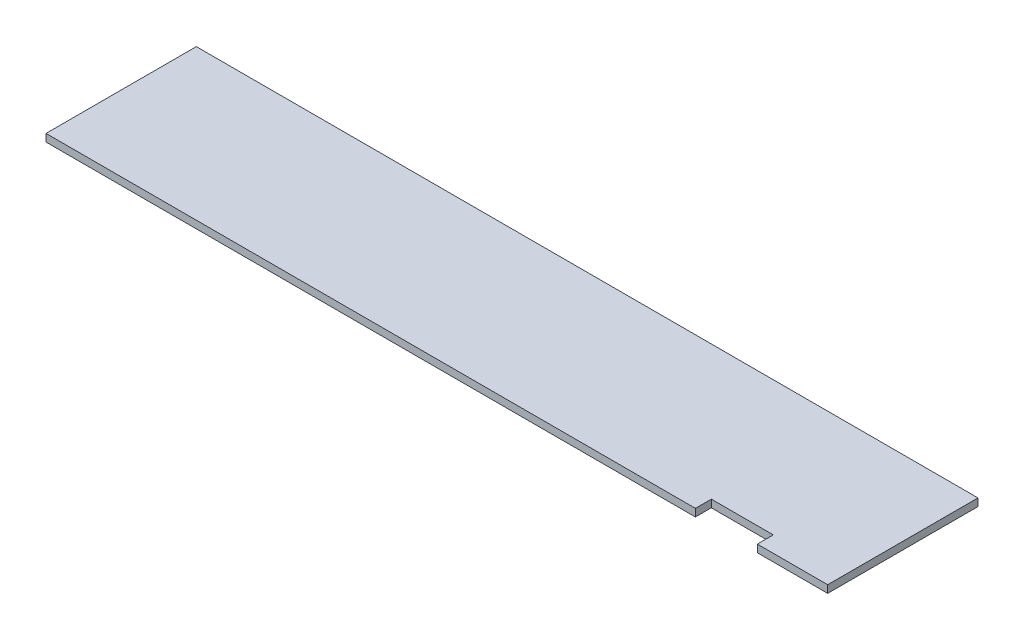
from build123d import *

# Parameters (mm, degrees)
BOSS_EXTRUDE1_DEPTH = 1.5875


with BuildPart() as part:
    # Sketch3 → Boss-Extrude1 (new, symmetric)
    with BuildSketch(Plane(origin=(0, 0, 0), x_dir=(1, 0, 0), z_dir=(0, 1, 0))):
        Polygon((1643.3038, -317.119), (1643.3038, -323.85), (1673.0218, -323.85), (1673.0218, -260.35), (1342.8218, -260.35), (1342.8218, -323.85), (1617.1418, -323.85), (1617.1418, -317.119), align=None)
    extrude(amount=BOSS_EXTRUDE1_DEPTH, both=True)


solid = part.part
